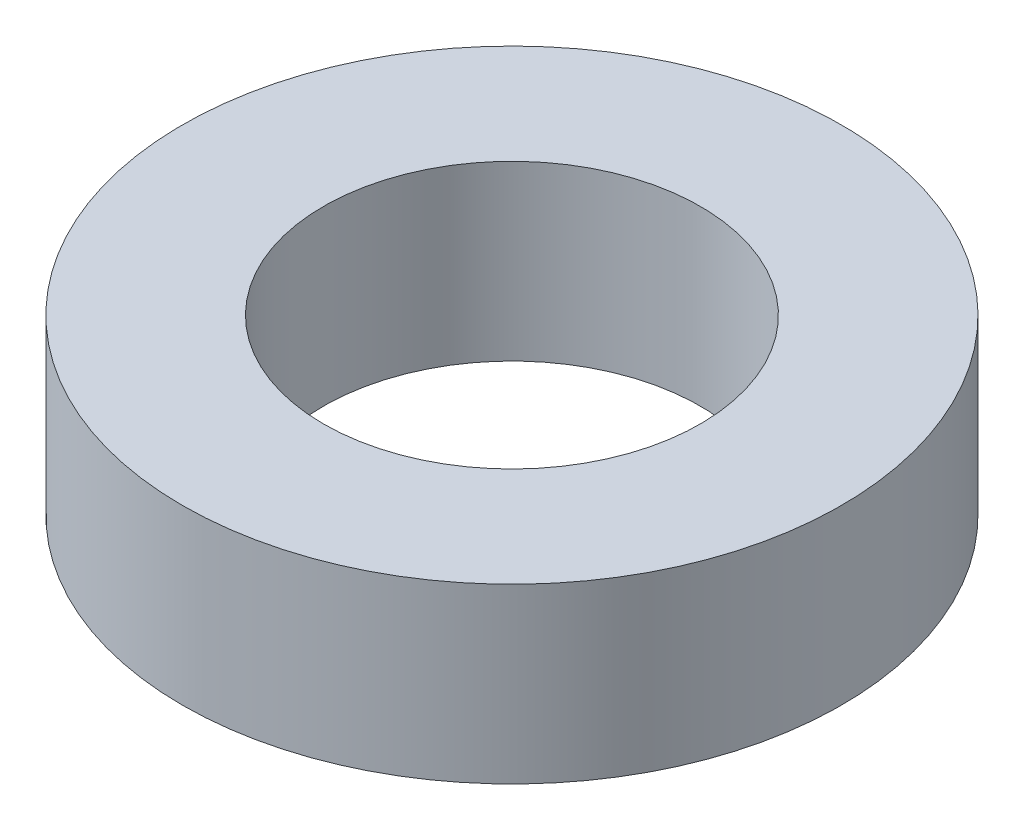
from build123d import *

# Parameters (mm, degrees)
SKETCH1_R           = 5.334
SKETCH1_R_2         = 3.05
BOSS_EXTRUDE1_DEPTH = 2.8


with BuildPart() as part:
    # Sketch1 → Boss-Extrude1 (new body)
    with BuildSketch(Plane(origin=(0, 0, 0), x_dir=(1, 0, 0), z_dir=(0, 1, 0))):
        with Locations(Location((0, 0, 0), (0, 0, 270))):
            Circle(SKETCH1_R)
        with Locations(Location((0, 0, 0), (0, 0, 270))):
            Circle(SKETCH1_R_2, mode=Mode.SUBTRACT)
    extrude(amount=BOSS_EXTRUDE1_DEPTH)


solid = part.part
